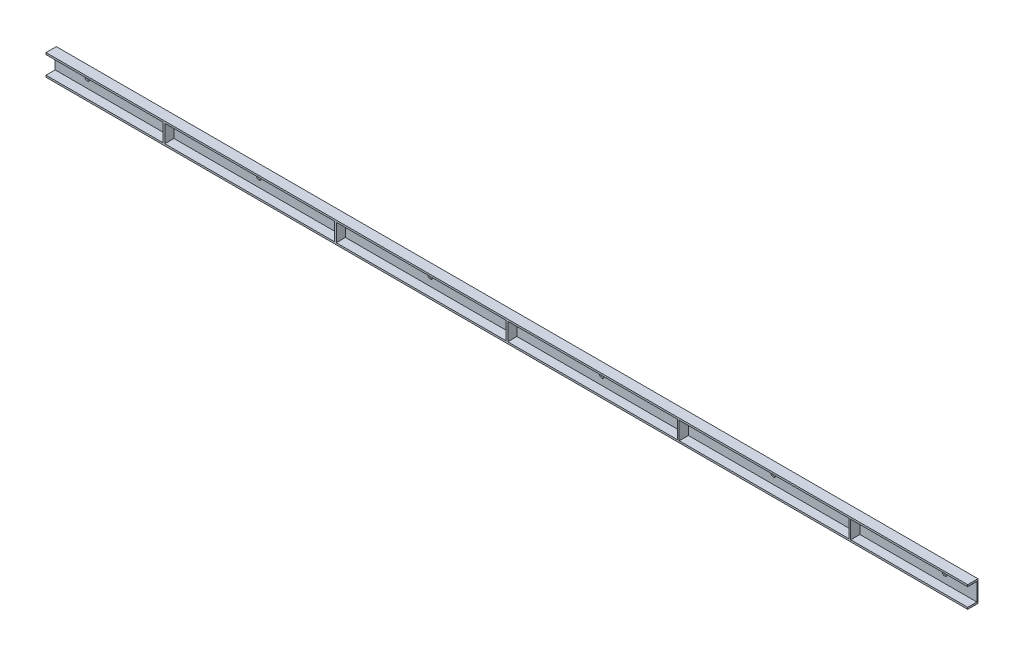
from build123d import *

# Parameters (mm, degrees)
SKETCH_1_W             = 4300
SKETCH_1_H             = 100
EXTRUDE_1_DEPTH        = 48
SKETCH_2_W             = 4300
SKETCH_2_H             = 83
CUT_EXTRUDE_2_DEPTH    = 42.7
SKETCH_3_W             = 8.5
SKETCH_3_H             = 83
EXTRUDE_3_DEPTH        = 42.7
PATTERN_LINEAR_1_COUNT = 5
PATTERN_LINEAR_1_PITCH = 800
SKETCH_4_R             = 11.5
CUT_EXTRUDE_4_DEPTH    = 4302.430459742
PATTERN_LINEAR_2_COUNT = 6
PATTERN_LINEAR_2_PITCH = 800


with BuildPart() as part:
    # 草图1 → 拉伸1 (new body)
    with BuildSketch(Plane.XY):
        with Locations((2150, 50)):
            Rectangle(SKETCH_1_W, SKETCH_1_H)
    extrude(amount=EXTRUDE_1_DEPTH)

    # 草图2 → 拉伸2 (cut)
    with BuildSketch(Plane.XY.offset(48)):
        with Locations((2150, 50)):
            Rectangle(SKETCH_2_W, SKETCH_2_H)
    extrude(amount=-CUT_EXTRUDE_2_DEPTH, mode=Mode.SUBTRACT)

    # 草图3 → 拉伸3 (add)
    with BuildSketch(Plane.XY.offset(5.3)):
        with Locations((550, 50)):
            Rectangle(SKETCH_3_W, SKETCH_3_H)
    extrude_3 = extrude(amount=EXTRUDE_3_DEPTH)

    # 阵列(线性)1: 拉伸3 ×5
    with Locations(*[(i * PATTERN_LINEAR_1_PITCH, 0, 0) for i in range(1, PATTERN_LINEAR_1_COUNT)]):
        add(extrude_3)

    # 草图4 → 拉伸4 (cut, through all)
    with BuildSketch(Plane(origin=(0, 0, 0), x_dir=(-1, 0, 0), z_dir=(0, 0, -1))):
        with Locations((-4150, 50)):
            Circle(SKETCH_4_R)
    cut_extrude_4 = extrude(amount=-CUT_EXTRUDE_4_DEPTH, mode=Mode.SUBTRACT)

    # 阵列(线性)2: 拉伸4 ×6
    with Locations(*[(-i * PATTERN_LINEAR_2_PITCH, 0, 0) for i in range(1, PATTERN_LINEAR_2_COUNT)]):
        add(cut_extrude_4, mode=Mode.SUBTRACT)


solid = part.part
